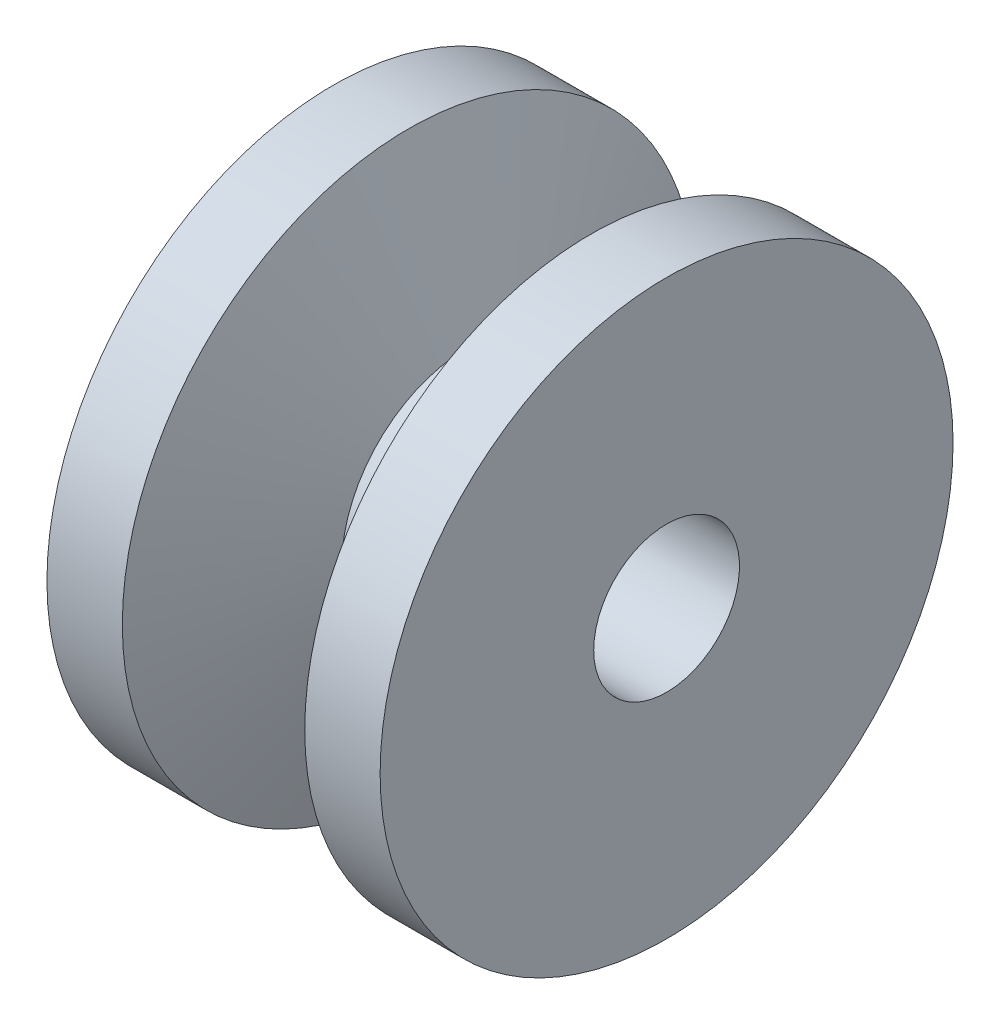
from build123d import *


with BuildPart() as part:
    # Sketch1 → Revolve1 (revolve)
    with BuildSketch(Plane(origin=(0, 0, 0), x_dir=(1, 0, 0), z_dir=(0, 1, 0)), mode=Mode.PRIVATE) as revolve1_sk:
        Polygon((0, 14.478), (3.81, 14.478), (6.768350064, 6.35), (10.070350064, 6.35), (13.028700128, 14.478), (16.838700128, 14.478), (16.838700128, 3.683), (0, 3.683), align=None)
    revolve(revolve1_sk.sketch.rotate(Axis((0, 0, 0), (1, 0, 0)), 180), axis=Axis((0, 0, 0), (1, 0, 0)))


solid = part.part
